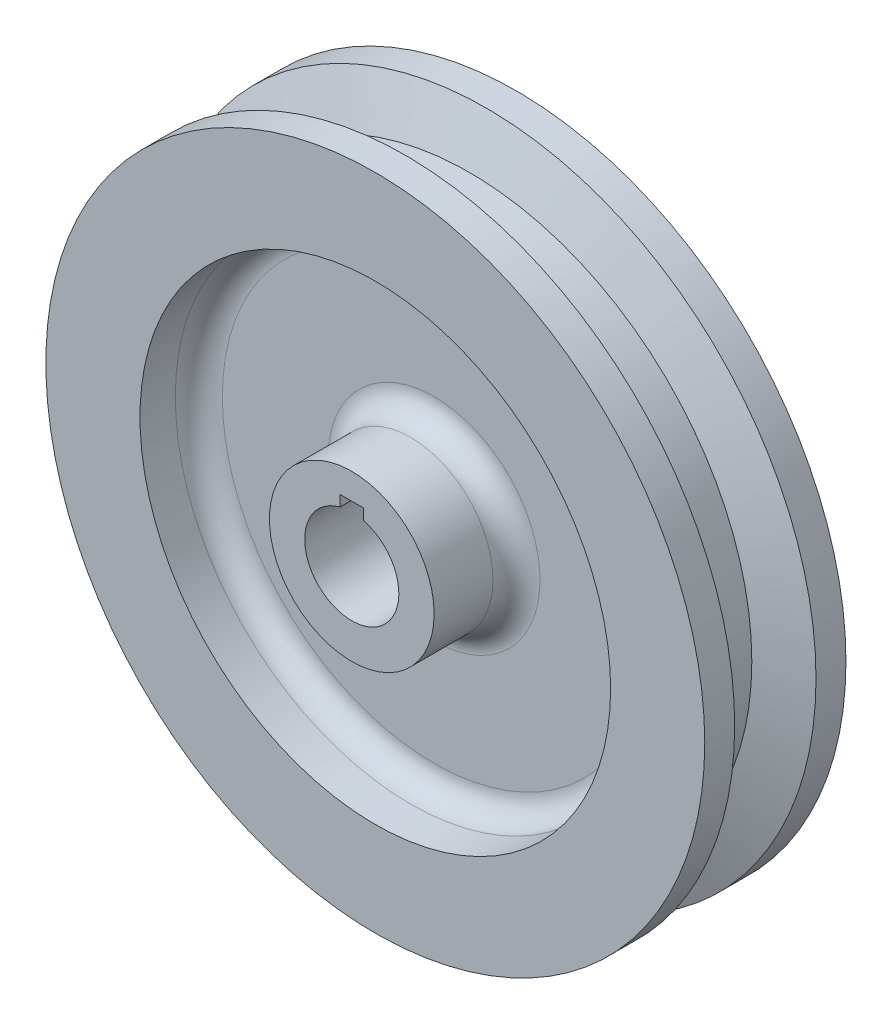
from build123d import *

# Parameters (mm, degrees)
FILLET1_R          = 0.25
SKETCH2_W          = 0.25
SKETCH2_H          = 0.25
CUT_EXTRUDE1_DEPTH = 6.338539126


with BuildPart() as part:
    # Sketch1 → Revolve1 (revolve)
    with BuildSketch(Plane(origin=(0, 0, 0), x_dir=(0, 0, -1), z_dir=(1, 0, 0)), mode=Mode.PRIVATE) as revolve1_sk:
        Polygon((-1, 0.5), (1, 0.5), (1, 0.875), (0.125, 0.875), (0.125, 2.5), (0.75, 2.5), (0.75, 3.5), (0.431985117, 3.5), (0.25, 3), (-0.25, 3), (-0.431985117, 3.5), (-0.75, 3.5), (-0.75, 2.5), (-0.125, 2.5), (-0.125, 0.875), (-1, 0.875), align=None)
    revolve(revolve1_sk.sketch.rotate(Axis((0, 0, 48.379703039), (0, 0, -1)), 90), axis=Axis((0, 0, 48.379703039), (0, 0, -1)))

    # Fillet1
    fillet1_edges = [part.edges().sort_by_distance(p)[0] for p in [
        (-0.875, 0, 0.125),
        (-2.5, 0, 0.125),
        (-2.5, 0, -0.125),
        (-0.875, 0, -0.125),
    ]]
    fillet(fillet1_edges, radius=FILLET1_R)

    # Sketch2 → Cut-Extrude1 (cut, through all)
    with BuildSketch(Plane.XY.offset(1)):
        with Locations((0, 0.475)):
            Rectangle(SKETCH2_W, SKETCH2_H)
    extrude(amount=-CUT_EXTRUDE1_DEPTH, mode=Mode.SUBTRACT)


solid = part.part
